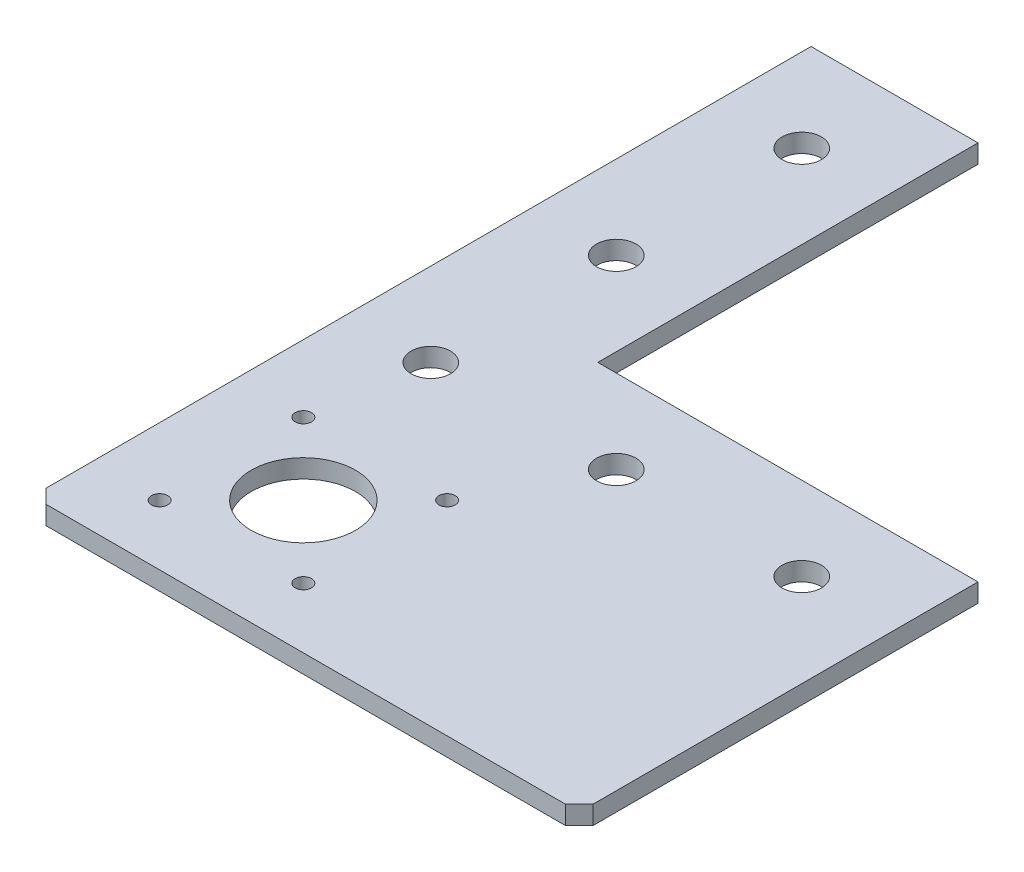
from build123d import *

# Parameters (mm, degrees)
SKETCH1_R           = 4.25
BOSS_EXTRUDE1_DEPTH = 4
SKETCH1_3_R         = 1.75
SKETCH1_3_R_2       = 11.25
BOSS_EXTRUDE2_DEPTH = 4
CHAMFER1_SIZE       = 3


with BuildPart() as part:
    # Sketch1 → Boss-Extrude1 (new body)
    with BuildSketch(Plane(origin=(0, 0, 0), x_dir=(1, 0, 0), z_dir=(0, 1, 0))):
        Polygon((-30, 88), (-30, -30), (88, -30.072989915), (88, -30), (88, 6), (6, 6), (6, 88), align=None)
        with Locations((-12, -12.011130611)):
            Circle(SKETCH1_R, mode=Mode.SUBTRACT)
        with Locations((28, -12.011130611)):
            Circle(SKETCH1_R, mode=Mode.SUBTRACT)
        with Locations((68, -12.011130611)):
            Circle(SKETCH1_R, mode=Mode.SUBTRACT)
        with Locations((-12, 27.988869389)):
            Circle(SKETCH1_R, mode=Mode.SUBTRACT)
        with Locations((-12, 67.988869389)):
            Circle(SKETCH1_R, mode=Mode.SUBTRACT)
    extrude(amount=BOSS_EXTRUDE1_DEPTH)

    # Sketch1<3> → Boss-Extrude2 (add)
    with BuildSketch(Plane(origin=(0, 0, 0), x_dir=(1, 0, 0), z_dir=(0, 1, 0))):
        Polygon((88, -30.072989915), (-30, -30), (-30, -80), (88, -80), align=None)
        with Locations((-15.5, -67)):
            Circle(SKETCH1_3_R, mode=Mode.SUBTRACT)
        with Locations((15.5, -67)):
            Circle(SKETCH1_3_R, mode=Mode.SUBTRACT)
        with Locations((0, -51.5)):
            Circle(SKETCH1_3_R_2, mode=Mode.SUBTRACT)
        with Locations((-15.5, -36)):
            Circle(SKETCH1_3_R, mode=Mode.SUBTRACT)
        with Locations((15.5, -36)):
            Circle(SKETCH1_3_R, mode=Mode.SUBTRACT)
    extrude(amount=BOSS_EXTRUDE2_DEPTH)

    # Chamfer1
    chamfer1_edges = [part.edges().sort_by_distance(p)[0] for p in [
        (88, 2, 80),
        (-30, 2, 80),
    ]]
    chamfer(chamfer1_edges, length=CHAMFER1_SIZE)


solid = part.part
